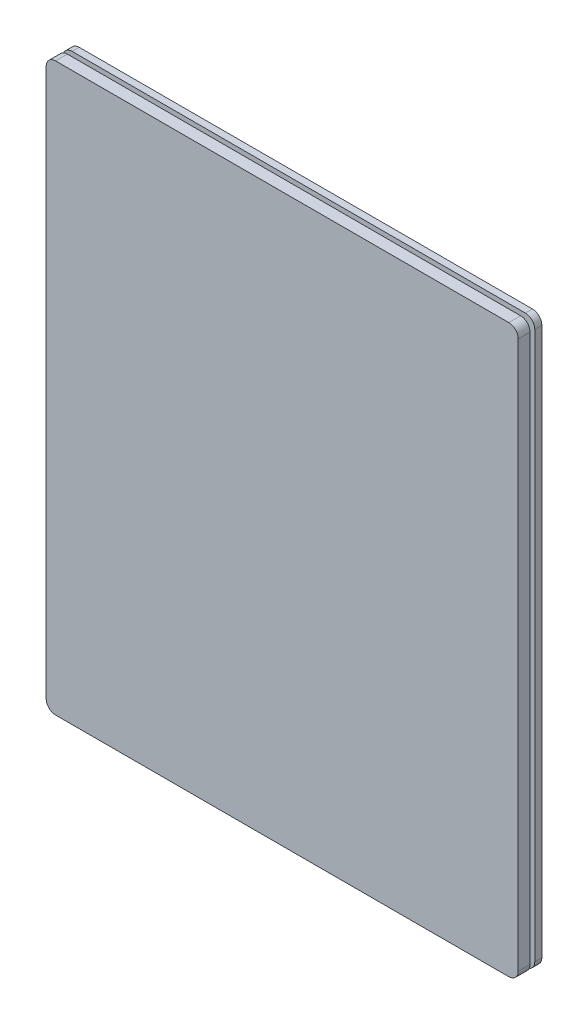
from build123d import *

# Parameters (mm, degrees)
SKETCH_1_W          = 10
SKETCH_1_H          = 12
EXTRUDE_1_DEPTH     = 0.6
SKETCH_2_W          = 10
SKETCH_2_H          = 12
CUT_EXTRUDE_1_DEPTH = 0.1
SKETCH_4_W          = 10
SKETCH_4_H          = 12
CUT_EXTRUDE_3_DEPTH = 0.05
FILLET_1_R          = 0.2


with BuildPart() as part:
    # 草图1 → 凸台-拉伸1 (new body)
    with BuildSketch(Plane.XY):
        with Locations((-0.081339713, 0.803827751)):
            Rectangle(SKETCH_1_W, SKETCH_1_H)
    extrude(amount=EXTRUDE_1_DEPTH)

    # 草图2 → 切除-拉伸1 (cut)
    with BuildSketch(Plane(origin=(0, 0, 0), x_dir=(-1, 0, 0), z_dir=(0, 0, -1))):
        with Locations((0.081339713, 0.803827751)):
            Rectangle(SKETCH_2_W, SKETCH_2_H)
        with BuildLine():
            Line((-2.712551899, 5.7889264), (2.884041266, 5.7889264))
            ThreePointArc((2.884041266, 5.7889264), (3.591148047, 5.496033181), (3.884041266, 4.7889264))
            Line((3.884041266, 4.7889264), (3.884041266, -3.115928634))
            ThreePointArc((3.884041266, -3.115928634), (3.591148047, -3.823035415), (2.884041266, -4.115928634))
            Line((2.884041266, -4.115928634), (-2.712551899, -4.115928634))
            ThreePointArc((-2.712551899, -4.115928634), (-3.419658681, -3.823035415), (-3.712551899, -3.115928634))
            Line((-3.712551899, -3.115928634), (-3.712551899, 4.7889264))
            ThreePointArc((-3.712551899, 4.7889264), (-3.419658681, 5.496033181), (-2.712551899, 5.7889264))
        make_face(mode=Mode.SUBTRACT)
    extrude(amount=-CUT_EXTRUDE_1_DEPTH, mode=Mode.SUBTRACT)

    # 草图4 → 切除-拉伸3 (cut, symmetric)
    with BuildSketch(Plane.XY.offset(0.3)):
        with Locations((-0.081339713, 0.803827751)):
            Rectangle(SKETCH_4_W, SKETCH_4_H)
        Polygon((0, 1.877578929), (-0.909343659, 0.803827751), (0, -0.374397758), (0.997821393, 0.803827751), align=None, mode=Mode.SUBTRACT)
    extrude(amount=CUT_EXTRUDE_3_DEPTH, both=True, mode=Mode.SUBTRACT)

    # 圆角1
    fillet_1_edges = [part.edges().sort_by_distance(p)[0] for p in [
        (-5.081339713, 6.803827751, 0.175),
        (4.918660287, 6.803827751, 0.175),
        (4.918660287, -5.196172249, 0.175),
        (-5.081339713, -5.196172249, 0.175),
        (-5.081339713, 6.803827751, 0.475),
        (4.918660287, 6.803827751, 0.475),
        (4.918660287, -5.196172249, 0.475),
        (-5.081339713, -5.196172249, 0.475),
    ]]
    fillet(fillet_1_edges, radius=FILLET_1_R)


solid = part.part
